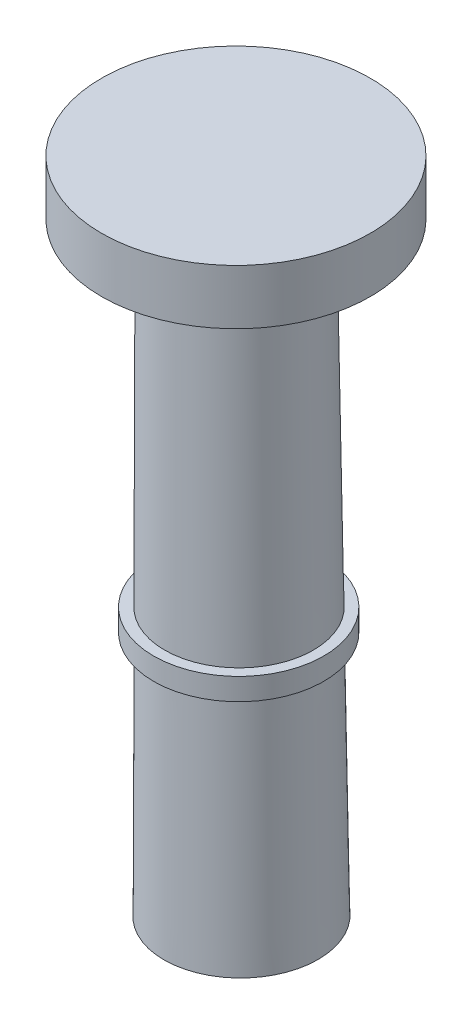
from build123d import *

# Parameters (mm, degrees)
SKETCH3_R           = 24.5
BOSS_EXTRUDE1_DEPTH = 10
SKETCH4_R           = 15.5
BOSS_EXTRUDE3_DEPTH = 4


with BuildPart() as part:
    # Sketch1 → Revolve1 (revolve)
    with BuildSketch(Plane.XY):
        Polygon((-50.994307358, 48.889927559), (-50.994307358, -61.110072441), (-36.994307358, -61.110072441), (-37.994307358, 48.889927559), align=None)
    revolve(axis=Axis((-37.994307358, 48.889927559, 0), (0.009090533456791595, -0.9999586802470746, 0)))

    # Sketch3 → Boss-Extrude1 (add)
    with BuildSketch(Plane(origin=(0, 48.544964037, 0), x_dir=(1, 0, 0), z_dir=(0, 1, 0))):
        with Locations(Location((-37.994307358, 0, 0), (0, 0, 270))):
            Circle(SKETCH3_R)
    extrude(amount=BOSS_EXTRUDE1_DEPTH)

    # Sketch4 → Boss-Extrude3 (add)
    with BuildSketch(Plane(origin=(0, -16.455035963, 0), x_dir=(1, 0, 0), z_dir=(0, 1, 0))):
        with Locations(Location((-37.494307358, 0, 0), (0, 0, 270))):
            Circle(SKETCH4_R)
    extrude(amount=BOSS_EXTRUDE3_DEPTH)


solid = part.part
